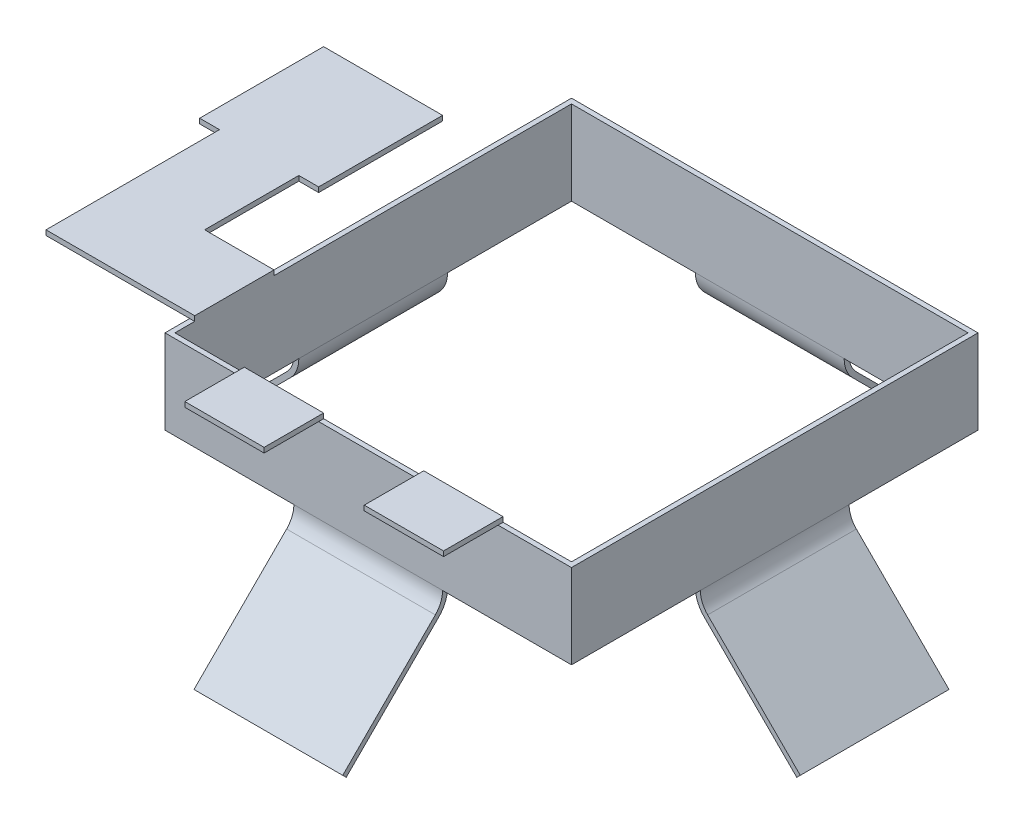
from build123d import *

# Parameters (mm, degrees)
SKETCH1_W           = 8.2
SKETCH1_H           = 8.2
SKETCH1_W_2         = 8
SKETCH1_H_2         = 8
BOSS_EXTRUDE1_DEPTH = 1.7
BOSS_EXTRUDE2_DEPTH = 1.5
CIRPATTERN1_COUNT   = 4
BOSS_EXTRUDE3_DEPTH = 0.1
SKETCH4_W           = 1.6
SKETCH4_H           = 1.2
BOSS_EXTRUDE4_DEPTH = 0.1


with BuildPart() as part:
    # Sketch1 → Boss-Extrude1 (new body)
    with BuildSketch(Plane(origin=(0, 0, 0), x_dir=(1, 0, 0), z_dir=(0, 1, 0))):
        Rectangle(SKETCH1_W, SKETCH1_H)
        Rectangle(SKETCH1_W_2, SKETCH1_H_2, mode=Mode.SUBTRACT)
    extrude(amount=BOSS_EXTRUDE1_DEPTH)

    # Sketch2 → Boss-Extrude2 (add, symmetric)
    with BuildSketch(Plane.ZY):
        with BuildLine():
            Line((6.115237938, -2.222344719), (4.246446609, -0.353553391))
            ThreePointArc((4.246446609, -0.353553391), (4.138060234, -0.191341716), (4.1, 0))
            Line((4.1, 0), (4.1, 0.022895615))
            Line((4.1, 0.022895615), (4, 0.022895615))
            Line((4, 0.022895615), (4, 0))
            ThreePointArc((4, 0), (4.04567228, -0.229610059), (4.175735931, -0.424264069))
            Line((4.175735931, -0.424264069), (6.04452726, -2.293055398))
            Line((6.04452726, -2.293055398), (6.115237938, -2.222344719))
        make_face()
    boss_extrude2 = extrude(amount=BOSS_EXTRUDE2_DEPTH, both=True)

    # CirPattern1: Boss-Extrude2 ×4 about axis
    cirpattern1_axis = Axis((0, 0, 0), (0, 1, 0))
    for i in range(1, CIRPATTERN1_COUNT):
        add(boss_extrude2.rotate(cirpattern1_axis, i * 360 / CIRPATTERN1_COUNT))

    # Sketch3 → Boss-Extrude3 (add)
    with BuildSketch(Plane(origin=(0, 1.7, 0), x_dir=(1, 0, 0), z_dir=(0, 1, 0))):
        Polygon((-4, -3.6), (-5.4, -3.6), (-7, -3.6), (-7, -0.1), (-7.400115841, -0.1), (-7.400115841, 2.4), (-7, 2.4), (-5.4, 2.4), (-5.000115841, 2.4), (-5.000115841, -0.1), (-5.4, -0.1), (-5.4, -2), (-4, -2), align=None)
    extrude(amount=BOSS_EXTRUDE3_DEPTH)

    # Sketch4 → Boss-Extrude4 (add)
    with BuildSketch(Plane(origin=(0, 1.7, 0), x_dir=(1, 0, 0), z_dir=(0, 1, 0))):
        with Locations((-1.8, -4.6)):
            Rectangle(SKETCH4_W, SKETCH4_H)
        with Locations((1.819415949, -4.6)):
            Rectangle(SKETCH4_W, SKETCH4_H)
    extrude(amount=BOSS_EXTRUDE4_DEPTH)


solid = part.part
